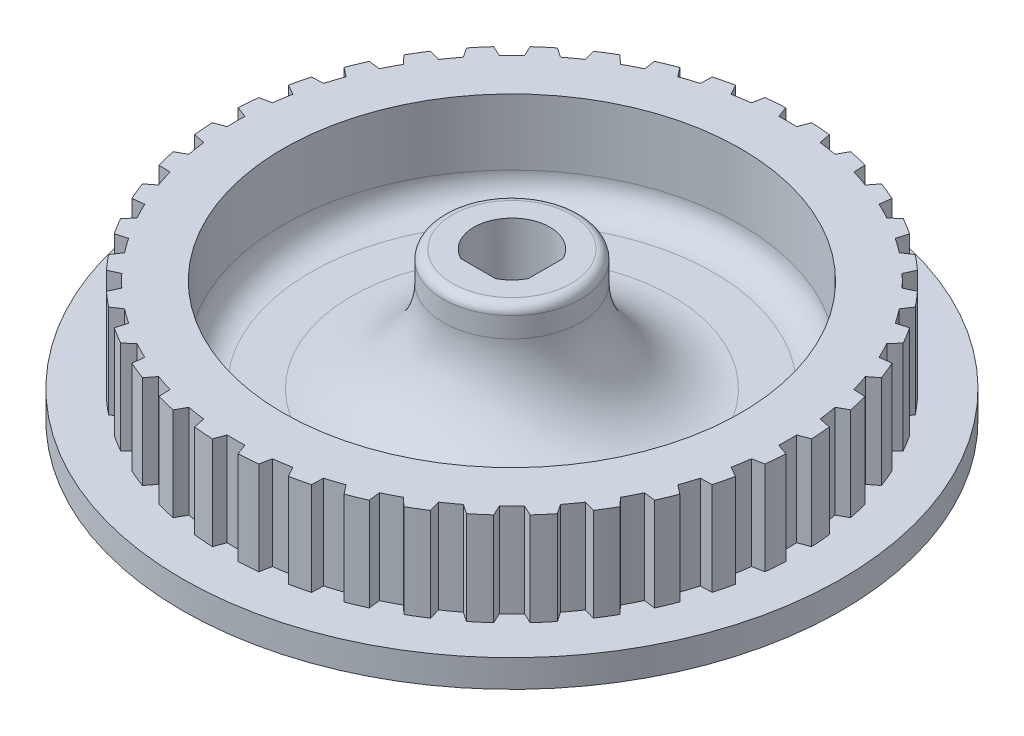
from build123d import *
from build123d.topology import SkipClean

# Parameters (mm, degrees)
TEETH_DEPTH             = 10.2
SKETCH_2_R              = 36
BASE_DEPTH              = 3
CORNER_HOLE_DEPTH       = 7
SKETCH_6_R              = 25
SKETCH_6_R_2            = 7.5
SAVE_PLASTIC_HOLE_DEPTH = 10.2
ROUND_START             = -6.2
SKETCH_7_R              = 4.15
ROUND_HOLE_DEPTH        = 6.2
PIN_START               = 3
SKETCH_9_R              = 7.5
PIN_DEPTH               = 3
CHAMFER_1_SIZE          = 0.5
CHAMFER_1_SIZE2         = 2.83564091
FILLET_1_R              = 1
FILLET_2_R              = 3
FILLET_3_R              = 10


with BuildPart() as part:
    # Эскиз1 → teeth (new body)
    with BuildSketch(Plane(origin=(0, 0, 0), x_dir=(1, 0, 0), z_dir=(0, 1, 0))):
        with BuildLine():
            Line((0.975, 30.134230951), (1.406022177, 31.31845465))
            ThreePointArc((1.406022177, 31.31845465), (2.459692651, 31.253358413), (3.510573988, 31.15282283))
            Line((3.510573988, 31.15282283), (3.751036166, 29.915752166))
            ThreePointArc((3.751036166, 29.915752166), (4.716499121, 29.778803469), (5.67702843, 29.61070496))
            Line((5.67702843, 29.61070496), (6.28799741, 30.712922176))
            ThreePointArc((6.28799741, 30.712922176), (7.318512157, 30.483797004), (8.340728171, 30.220105122))
            Line((8.340728171, 30.220105122), (8.384709373, 28.960648279))
            ThreePointArc((8.384709373, 28.960648279), (9.31686238, 28.674353966), (10.23926958, 28.35806514))
            Line((10.23926958, 28.35806514), (11.015141278, 29.351135628))
            ThreePointArc((11.015141278, 29.351135628), (11.997125605, 28.963623344), (12.965505945, 28.543268131))
            Line((12.965505945, 28.543268131), (12.811923208, 27.292437116))
            ThreePointArc((12.811923208, 27.292437116), (13.687813567, 26.863846704), (14.54938593, 26.407155641))
            Line((14.54938593, 26.407155641), (15.47105581, 27.266626709))
            ThreePointArc((15.47105581, 27.266626709), (16.380330004, 26.730269153), (17.271029932, 26.163601149))
            Line((17.271029932, 26.163601149), (16.923664973, 24.952195573))
            ThreePointArc((16.923664973, 24.952195573), (17.721725357, 24.39186238), (18.501248112, 23.806014331))
            Line((18.501248112, 23.806014331), (19.546021603, 24.510722949))
            ThreePointArc((19.546021603, 24.510722949), (20.360196315, 23.838727022), (21.151283843, 23.139699475))
            Line((21.151283843, 23.139699475), (20.61868994, 21.997548163))
            ThreePointArc((20.61868994, 21.997548163), (21.319269453, 21.319269453), (21.997548163, 20.61868994))
            Line((21.997548163, 20.61868994), (23.139699475, 21.151283843))
            ThreePointArc((23.139699475, 21.151283843), (23.838727022, 20.360196315), (24.510722949, 19.546021603))
            Line((24.510722949, 19.546021603), (23.806014331, 18.501248112))
            ThreePointArc((23.806014331, 18.501248112), (24.39186238, 17.721725357), (24.952195573, 16.923664973))
            Line((24.952195573, 16.923664973), (26.163601149, 17.271029932))
            ThreePointArc((26.163601149, 17.271029932), (26.730269153, 16.380330004), (27.266626709, 15.47105581))
            Line((27.266626709, 15.47105581), (26.407155641, 14.54938593))
            ThreePointArc((26.407155641, 14.54938593), (26.863846704, 13.687813567), (27.292437116, 12.811923208))
            Line((27.292437116, 12.811923208), (28.543268131, 12.965505945))
            ThreePointArc((28.543268131, 12.965505945), (28.963623344, 11.997125605), (29.351135628, 11.015141278))
            Line((29.351135628, 11.015141278), (28.35806514, 10.23926958))
            ThreePointArc((28.35806514, 10.23926958), (28.674353966, 9.31686238), (28.960648279, 8.384709373))
            Line((28.960648279, 8.384709373), (30.220105122, 8.340728171))
            ThreePointArc((30.220105122, 8.340728171), (30.483797004, 7.318512157), (30.712922176, 6.28799741))
            Line((30.712922176, 6.28799741), (29.61070496, 5.67702843))
            ThreePointArc((29.61070496, 5.67702843), (29.778803469, 4.716499121), (29.915752166, 3.751036166))
            Line((29.915752166, 3.751036166), (31.15282283, 3.510573988))
            ThreePointArc((31.15282283, 3.510573988), (31.253358413, 2.459692651), (31.31845465, 1.406022177))
            Line((31.31845465, 1.406022177), (30.134230951, 0.975))
            ThreePointArc((30.134230951, 0.975), (30.15, 0), (30.134230951, -0.975))
            Line((30.134230951, -0.975), (31.31845465, -1.406022177))
            ThreePointArc((31.31845465, -1.406022177), (31.253358413, -2.459692651), (31.15282283, -3.510573988))
            Line((31.15282283, -3.510573988), (29.915752166, -3.751036166))
            ThreePointArc((29.915752166, -3.751036166), (29.778803469, -4.716499121), (29.61070496, -5.67702843))
            Line((29.61070496, -5.67702843), (30.712922176, -6.28799741))
            ThreePointArc((30.712922176, -6.28799741), (30.483797004, -7.318512157), (30.220105122, -8.340728171))
            Line((30.220105122, -8.340728171), (28.960648279, -8.384709373))
            ThreePointArc((28.960648279, -8.384709373), (28.674353966, -9.31686238), (28.35806514, -10.23926958))
            Line((28.35806514, -10.23926958), (29.351135628, -11.015141278))
            ThreePointArc((29.351135628, -11.015141278), (28.963623344, -11.997125605), (28.543268131, -12.965505945))
            Line((28.543268131, -12.965505945), (27.292437116, -12.811923208))
            ThreePointArc((27.292437116, -12.811923208), (26.863846704, -13.687813567), (26.407155641, -14.54938593))
            Line((26.407155641, -14.54938593), (27.266626709, -15.47105581))
            ThreePointArc((27.266626709, -15.47105581), (26.730269153, -16.380330004), (26.163601149, -17.271029932))
            Line((26.163601149, -17.271029932), (24.952195573, -16.923664973))
            ThreePointArc((24.952195573, -16.923664973), (24.39186238, -17.721725357), (23.806014331, -18.501248112))
            Line((23.806014331, -18.501248112), (24.510722949, -19.546021603))
            ThreePointArc((24.510722949, -19.546021603), (23.838727022, -20.360196315), (23.139699475, -21.151283843))
            Line((23.139699475, -21.151283843), (21.997548163, -20.61868994))
            ThreePointArc((21.997548163, -20.61868994), (21.319269453, -21.319269453), (20.61868994, -21.997548163))
            Line((20.61868994, -21.997548163), (21.151283843, -23.139699475))
            ThreePointArc((21.151283843, -23.139699475), (20.360196315, -23.838727022), (19.546021603, -24.510722949))
            Line((19.546021603, -24.510722949), (18.501248112, -23.806014331))
            ThreePointArc((18.501248112, -23.806014331), (17.721725357, -24.39186238), (16.923664973, -24.952195573))
            Line((16.923664973, -24.952195573), (17.271029932, -26.163601149))
            ThreePointArc((17.271029932, -26.163601149), (16.380330004, -26.730269153), (15.47105581, -27.266626709))
            Line((15.47105581, -27.266626709), (14.54938593, -26.407155641))
            ThreePointArc((14.54938593, -26.407155641), (13.687813567, -26.863846704), (12.811923208, -27.292437116))
            Line((12.811923208, -27.292437116), (12.965505945, -28.543268131))
            ThreePointArc((12.965505945, -28.543268131), (11.997125605, -28.963623344), (11.015141278, -29.351135628))
            Line((11.015141278, -29.351135628), (10.23926958, -28.35806514))
            ThreePointArc((10.23926958, -28.35806514), (9.31686238, -28.674353966), (8.384709373, -28.960648279))
            Line((8.384709373, -28.960648279), (8.340728171, -30.220105122))
            ThreePointArc((8.340728171, -30.220105122), (7.318512157, -30.483797004), (6.28799741, -30.712922176))
            Line((6.28799741, -30.712922176), (5.67702843, -29.61070496))
            ThreePointArc((5.67702843, -29.61070496), (4.716499121, -29.778803469), (3.751036166, -29.915752166))
            Line((3.751036166, -29.915752166), (3.510573988, -31.15282283))
            ThreePointArc((3.510573988, -31.15282283), (2.459692651, -31.253358413), (1.406022177, -31.31845465))
            Line((1.406022177, -31.31845465), (0.975, -30.134230951))
            ThreePointArc((0.975, -30.134230951), (0, -30.15), (-0.975, -30.134230951))
            Line((-0.975, -30.134230951), (-1.406022177, -31.31845465))
            ThreePointArc((-1.406022177, -31.31845465), (-2.459692651, -31.253358413), (-3.510573988, -31.15282283))
            Line((-3.510573988, -31.15282283), (-3.751036166, -29.915752166))
            ThreePointArc((-3.751036166, -29.915752166), (-4.716499121, -29.778803469), (-5.67702843, -29.61070496))
            Line((-5.67702843, -29.61070496), (-6.28799741, -30.712922176))
            ThreePointArc((-6.28799741, -30.712922176), (-7.318512157, -30.483797004), (-8.340728171, -30.220105122))
            Line((-8.340728171, -30.220105122), (-8.384709373, -28.960648279))
            ThreePointArc((-8.384709373, -28.960648279), (-9.31686238, -28.674353966), (-10.23926958, -28.35806514))
            Line((-10.23926958, -28.35806514), (-11.015141278, -29.351135628))
            ThreePointArc((-11.015141278, -29.351135628), (-11.997125605, -28.963623344), (-12.965505945, -28.543268131))
            Line((-12.965505945, -28.543268131), (-12.811923208, -27.292437116))
            ThreePointArc((-12.811923208, -27.292437116), (-13.687813567, -26.863846704), (-14.54938593, -26.407155641))
            Line((-14.54938593, -26.407155641), (-15.47105581, -27.266626709))
            ThreePointArc((-15.47105581, -27.266626709), (-16.380330004, -26.730269153), (-17.271029932, -26.163601149))
            Line((-17.271029932, -26.163601149), (-16.923664973, -24.952195573))
            ThreePointArc((-16.923664973, -24.952195573), (-17.721725357, -24.39186238), (-18.501248112, -23.806014331))
            Line((-18.501248112, -23.806014331), (-19.546021603, -24.510722949))
            ThreePointArc((-19.546021603, -24.510722949), (-20.360196315, -23.838727022), (-21.151283843, -23.139699475))
            Line((-21.151283843, -23.139699475), (-20.61868994, -21.997548163))
            ThreePointArc((-20.61868994, -21.997548163), (-21.319269453, -21.319269453), (-21.997548163, -20.61868994))
            Line((-21.997548163, -20.61868994), (-23.139699475, -21.151283843))
            ThreePointArc((-23.139699475, -21.151283843), (-23.838727022, -20.360196315), (-24.510722949, -19.546021603))
            Line((-24.510722949, -19.546021603), (-23.806014331, -18.501248112))
            ThreePointArc((-23.806014331, -18.501248112), (-24.39186238, -17.721725357), (-24.952195573, -16.923664973))
            Line((-24.952195573, -16.923664973), (-26.163601149, -17.271029932))
            ThreePointArc((-26.163601149, -17.271029932), (-26.730269153, -16.380330004), (-27.266626709, -15.47105581))
            Line((-27.266626709, -15.47105581), (-26.407155641, -14.54938593))
            ThreePointArc((-26.407155641, -14.54938593), (-26.863846704, -13.687813567), (-27.292437116, -12.811923208))
            Line((-27.292437116, -12.811923208), (-28.543268131, -12.965505945))
            ThreePointArc((-28.543268131, -12.965505945), (-28.963623344, -11.997125605), (-29.351135628, -11.015141278))
            Line((-29.351135628, -11.015141278), (-28.35806514, -10.23926958))
            ThreePointArc((-28.35806514, -10.23926958), (-28.674353966, -9.31686238), (-28.960648279, -8.384709373))
            Line((-28.960648279, -8.384709373), (-30.220105122, -8.340728171))
            ThreePointArc((-30.220105122, -8.340728171), (-30.483797004, -7.318512157), (-30.712922176, -6.28799741))
            Line((-30.712922176, -6.28799741), (-29.61070496, -5.67702843))
            ThreePointArc((-29.61070496, -5.67702843), (-29.778803469, -4.716499121), (-29.915752166, -3.751036166))
            Line((-29.915752166, -3.751036166), (-31.15282283, -3.510573988))
            ThreePointArc((-31.15282283, -3.510573988), (-31.253358413, -2.459692651), (-31.31845465, -1.406022177))
            Line((-31.31845465, -1.406022177), (-30.134230951, -0.975))
            ThreePointArc((-30.134230951, -0.975), (-30.15, 0), (-30.134230951, 0.975))
            Line((-30.134230951, 0.975), (-31.31845465, 1.406022177))
            ThreePointArc((-31.31845465, 1.406022177), (-31.253358413, 2.459692651), (-31.15282283, 3.510573988))
            Line((-31.15282283, 3.510573988), (-29.915752166, 3.751036166))
            ThreePointArc((-29.915752166, 3.751036166), (-29.778803469, 4.716499121), (-29.61070496, 5.67702843))
            Line((-29.61070496, 5.67702843), (-30.712922176, 6.28799741))
            ThreePointArc((-30.712922176, 6.28799741), (-30.483797004, 7.318512157), (-30.220105122, 8.340728171))
            Line((-30.220105122, 8.340728171), (-28.960648279, 8.384709373))
            ThreePointArc((-28.960648279, 8.384709373), (-28.674353966, 9.31686238), (-28.35806514, 10.23926958))
            Line((-28.35806514, 10.23926958), (-29.351135628, 11.015141278))
            ThreePointArc((-29.351135628, 11.015141278), (-28.963623344, 11.997125605), (-28.543268131, 12.965505945))
            Line((-28.543268131, 12.965505945), (-27.292437116, 12.811923208))
            ThreePointArc((-27.292437116, 12.811923208), (-26.863846704, 13.687813567), (-26.407155641, 14.54938593))
            Line((-26.407155641, 14.54938593), (-27.266626709, 15.47105581))
            ThreePointArc((-27.266626709, 15.47105581), (-26.730269153, 16.380330004), (-26.163601149, 17.271029932))
            Line((-26.163601149, 17.271029932), (-24.952195573, 16.923664973))
            ThreePointArc((-24.952195573, 16.923664973), (-24.39186238, 17.721725357), (-23.806014331, 18.501248112))
            Line((-23.806014331, 18.501248112), (-24.510722949, 19.546021603))
            ThreePointArc((-24.510722949, 19.546021603), (-23.838727022, 20.360196315), (-23.139699475, 21.151283843))
            Line((-23.139699475, 21.151283843), (-21.997548163, 20.61868994))
            ThreePointArc((-21.997548163, 20.61868994), (-21.319269453, 21.319269453), (-20.61868994, 21.997548163))
            Line((-20.61868994, 21.997548163), (-21.151283843, 23.139699475))
            ThreePointArc((-21.151283843, 23.139699475), (-20.360196315, 23.838727022), (-19.546021603, 24.510722949))
            Line((-19.546021603, 24.510722949), (-18.501248112, 23.806014331))
            ThreePointArc((-18.501248112, 23.806014331), (-17.721725357, 24.39186238), (-16.923664973, 24.952195573))
            Line((-16.923664973, 24.952195573), (-17.271029932, 26.163601149))
            ThreePointArc((-17.271029932, 26.163601149), (-16.380330004, 26.730269153), (-15.47105581, 27.266626709))
            Line((-15.47105581, 27.266626709), (-14.54938593, 26.407155641))
            ThreePointArc((-14.54938593, 26.407155641), (-13.687813567, 26.863846704), (-12.811923208, 27.292437116))
            Line((-12.811923208, 27.292437116), (-12.965505945, 28.543268131))
            ThreePointArc((-12.965505945, 28.543268131), (-11.997125605, 28.963623344), (-11.015141278, 29.351135628))
            Line((-11.015141278, 29.351135628), (-10.23926958, 28.35806514))
            ThreePointArc((-10.23926958, 28.35806514), (-9.31686238, 28.674353966), (-8.384709373, 28.960648279))
            Line((-8.384709373, 28.960648279), (-8.340728171, 30.220105122))
            ThreePointArc((-8.340728171, 30.220105122), (-7.318512157, 30.483797004), (-6.28799741, 30.712922176))
            Line((-6.28799741, 30.712922176), (-5.67702843, 29.61070496))
            ThreePointArc((-5.67702843, 29.61070496), (-4.716499121, 29.778803469), (-3.751036166, 29.915752166))
            Line((-3.751036166, 29.915752166), (-3.510573988, 31.15282283))
            ThreePointArc((-3.510573988, 31.15282283), (-2.459692651, 31.253358413), (-1.406022177, 31.31845465))
            Line((-1.406022177, 31.31845465), (-0.975, 30.134230951))
            ThreePointArc((-0.975, 30.134230951), (0, 30.15), (0.975, 30.134230951))
        make_face()
    extrude(amount=TEETH_DEPTH)

    # Эскиз2 → base (add)
    with BuildSketch(Plane(origin=(0, 0, 0), x_dir=(1, 0, 0), z_dir=(0, 1, 0))):
        with Locations(Location((0, 0, 0), (0, 0, 270))):
            Circle(SKETCH_2_R)
    extrude(amount=-BASE_DEPTH)

    # Эскиз5 → corner hole (cut)
    with BuildSketch(Plane(origin=(0, 10.2, 0), x_dir=(1, 0, 0), z_dir=(0, 1, 0))):
        with BuildLine():
            Line((3.689512163, 1.9), (3.689512163, -1.9))
            ThreePointArc((3.689512163, -1.9), (2.934493142, -2.934493142), (1.9, -3.689512163))
            Line((1.9, -3.689512163), (-1.9, -3.689512163))
            ThreePointArc((-1.9, -3.689512163), (-2.934493142, 2.934493142), (3.689512163, 1.9))
        make_face()
    extrude(amount=-CORNER_HOLE_DEPTH, mode=Mode.SUBTRACT)

    # Эскиз6 → save plastic hole (cut)
    with BuildSketch(Plane.XZ.offset(-10.2)):
        with Locations(Location((0, 0, 0), (0, 0, 90))):
            Circle(SKETCH_6_R)
        with Locations(Location((0, 0, 0), (0, 0, 90))):
            Circle(SKETCH_6_R_2, mode=Mode.SUBTRACT)
    extrude(amount=SAVE_PLASTIC_HOLE_DEPTH, mode=Mode.SUBTRACT)

    # Эскиз7 → round hole (cut)
    with SkipClean():  # the faces are left unmerged after this step: merging them gives an invalid solid
        with BuildSketch(Plane.XZ.offset(3).offset(ROUND_START)):
            with Locations(Location((0, 0, 0), (0, 0, 62.752744814))):
                Circle(SKETCH_7_R)
        extrude(amount=ROUND_HOLE_DEPTH, mode=Mode.SUBTRACT)

    # Эскиз9 → pin (add)
    with SkipClean():  # the faces are left unmerged after this step: merging them gives an invalid solid
        with BuildSketch(Plane(origin=(0, 10.2, 0), x_dir=(1, 0, 0), z_dir=(0, 1, 0)).offset(PIN_START)):
            with Locations(Location((0, 0, 0), (0, 0, 270))):
                Circle(SKETCH_9_R)
            with BuildLine():
                Line((3.689512163, 1.9), (3.689512163, -1.9))
                ThreePointArc((3.689512163, -1.9), (2.934493142, -2.934493142), (1.9, -3.689512163))
                Line((1.9, -3.689512163), (-1.9, -3.689512163))
                ThreePointArc((-1.9, -3.689512163), (-2.934493142, 2.934493142), (3.689512163, 1.9))
            make_face(mode=Mode.SUBTRACT)
        extrude(amount=-PIN_DEPTH)

    # Фаска1
    chamfer_1_edges = [part.edges().sort_by_distance(p)[0] for p in [
        (-1.9, -3, -3.689512163),
    ]]
    chamfer_1_side = [part.faces().sort_by_distance(p)[0] for p in [
        (0, -3, -34.981766235),
    ]]
    chamfer(chamfer_1_edges, length=CHAMFER_1_SIZE, length2=CHAMFER_1_SIZE2, reference=chamfer_1_side[0])

    # Скругление1
    fillet_1_edges = [part.edges().sort_by_distance(p)[0] for p in [
        (0, 13.2, -7.5),
    ]]
    fillet(fillet_1_edges, radius=FILLET_1_R)

    # Скругление2
    fillet_2_edges = [part.edges().sort_by_distance(p)[0] for p in [
        (0, 0, -25),
    ]]
    fillet(fillet_2_edges, radius=FILLET_2_R)

    # Скругление3
    fillet_3_edges = [part.edges().sort_by_distance(p)[0] for p in [
        (0, 0, -7.5),
    ]]
    fillet(fillet_3_edges, radius=FILLET_3_R)


solid = part.part
